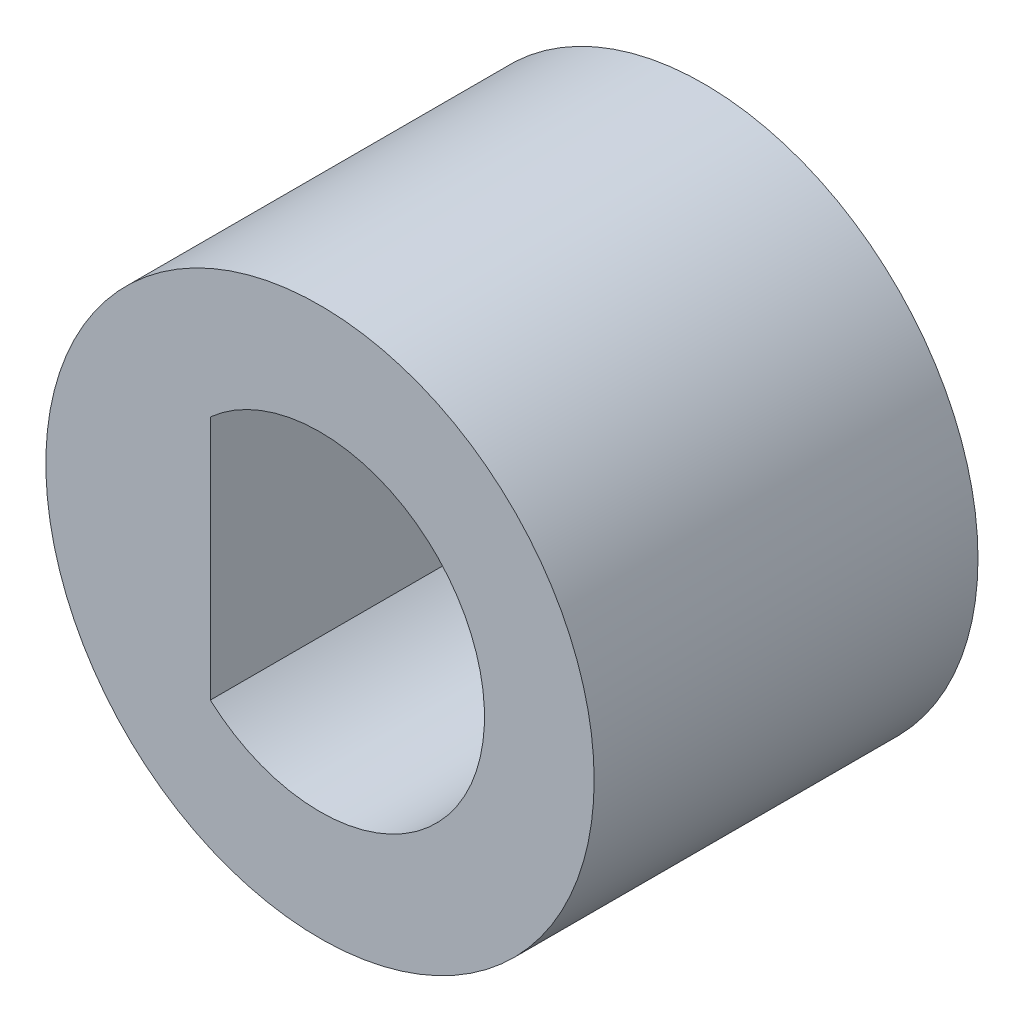
from build123d import *

# Parameters (mm, degrees)
SKETCH1_R           = 5
BOSS_EXTRUDE1_DEPTH = 7


with BuildPart() as part:
    # Sketch1 → Boss-Extrude1 (new body)
    with BuildSketch(Plane.XY):
        Circle(SKETCH1_R)
        with BuildLine():
            Line((-2, -2.236067977), (-2, 2.236067977))
            ThreePointArc((-2, 2.236067977), (3, 0), (-2, -2.236067977))
        make_face(mode=Mode.SUBTRACT)
    extrude(amount=BOSS_EXTRUDE1_DEPTH)


solid = part.part
